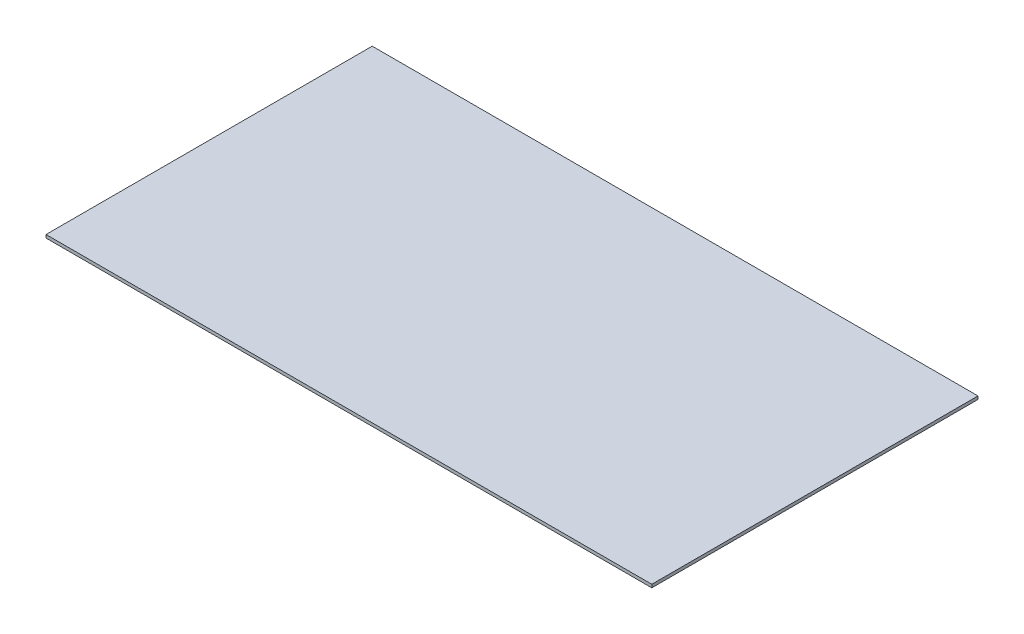
from build123d import *

# Parameters (mm, degrees)
SKETCH1_W           = 1050
SKETCH1_H           = 10
BOSS_EXTRUDE1_DEPTH = 1950


with BuildPart() as part:
    # Sketch1 → Boss-Extrude1 (new body)
    with BuildSketch(Plane(origin=(0, 0, 0), x_dir=(0, 0, -1), z_dir=(1, 0, 0))):
        Rectangle(SKETCH1_W, SKETCH1_H)
    extrude(amount=BOSS_EXTRUDE1_DEPTH)


solid = part.part
